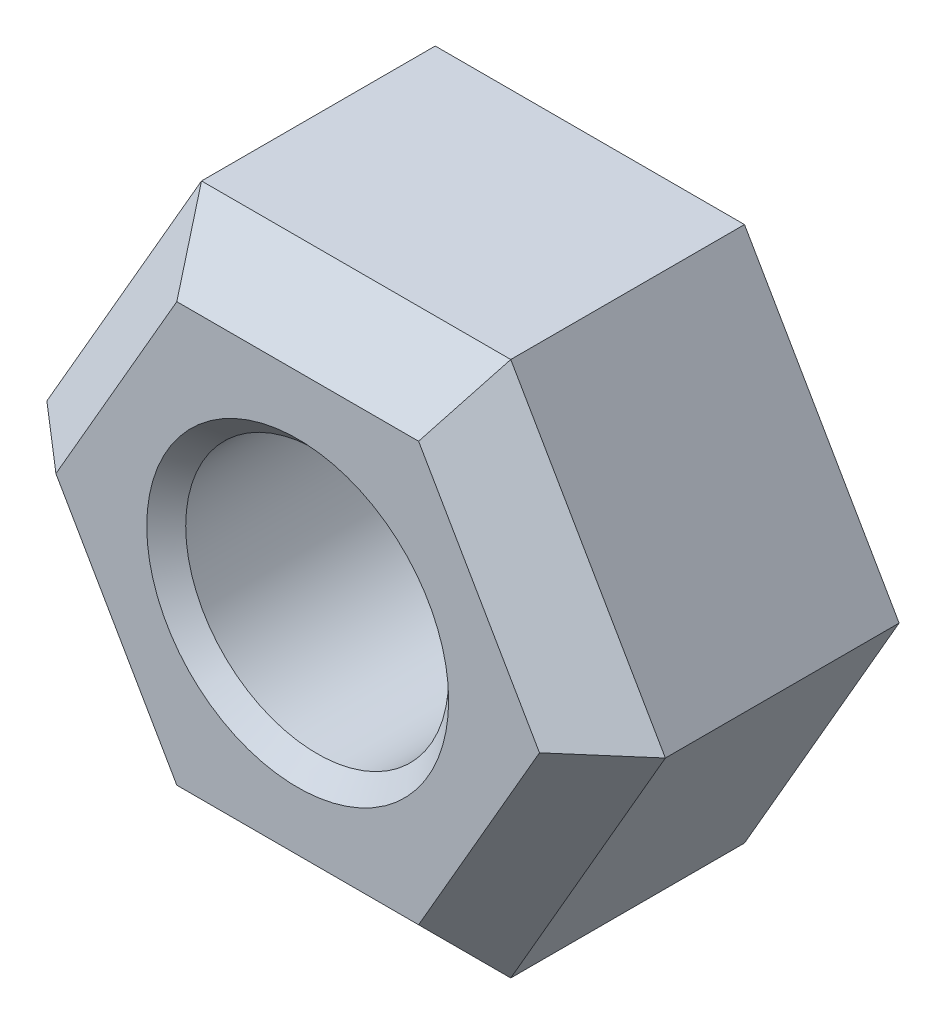
from build123d import *

# Parameters (mm, degrees)
SKETCH_1_R      = 1.35
EXTRUDE_1_DEPTH = 3
CHAMFER_1_SIZE  = 0.6
CHAMFER_2_SIZE  = 0.2


with BuildPart() as part:
    # ｽｹｯﾁ1 → ﾎﾞｽ - 押し出し1 (new body)
    with BuildSketch(Plane.XY):
        Polygon((3.175426481, 0), (1.58771324, 2.75), (-1.58771324, 2.75), (-3.175426481, 0), (-1.58771324, -2.75), (1.58771324, -2.75), align=None)
        Circle(SKETCH_1_R, mode=Mode.SUBTRACT)
    extrude(amount=EXTRUDE_1_DEPTH)

    # 面取り1
    chamfer_1_edges = [part.edges().sort_by_distance(p)[0] for p in [
        (0, 2.75, 3),
        (-2.38156986, 1.375, 3),
        (-2.38156986, -1.375, 3),
        (0, -2.75, 3),
        (2.38156986, -1.375, 3),
        (2.38156986, 1.375, 3),
    ]]
    chamfer(chamfer_1_edges, length=CHAMFER_1_SIZE)

    # 面取り2
    chamfer_2_edges = [part.edges().sort_by_distance(p)[0] for p in [
        (-1.35, 0, 0),
        (-1.35, 0, 3),
    ]]
    chamfer(chamfer_2_edges, length=CHAMFER_2_SIZE)


solid = part.part
